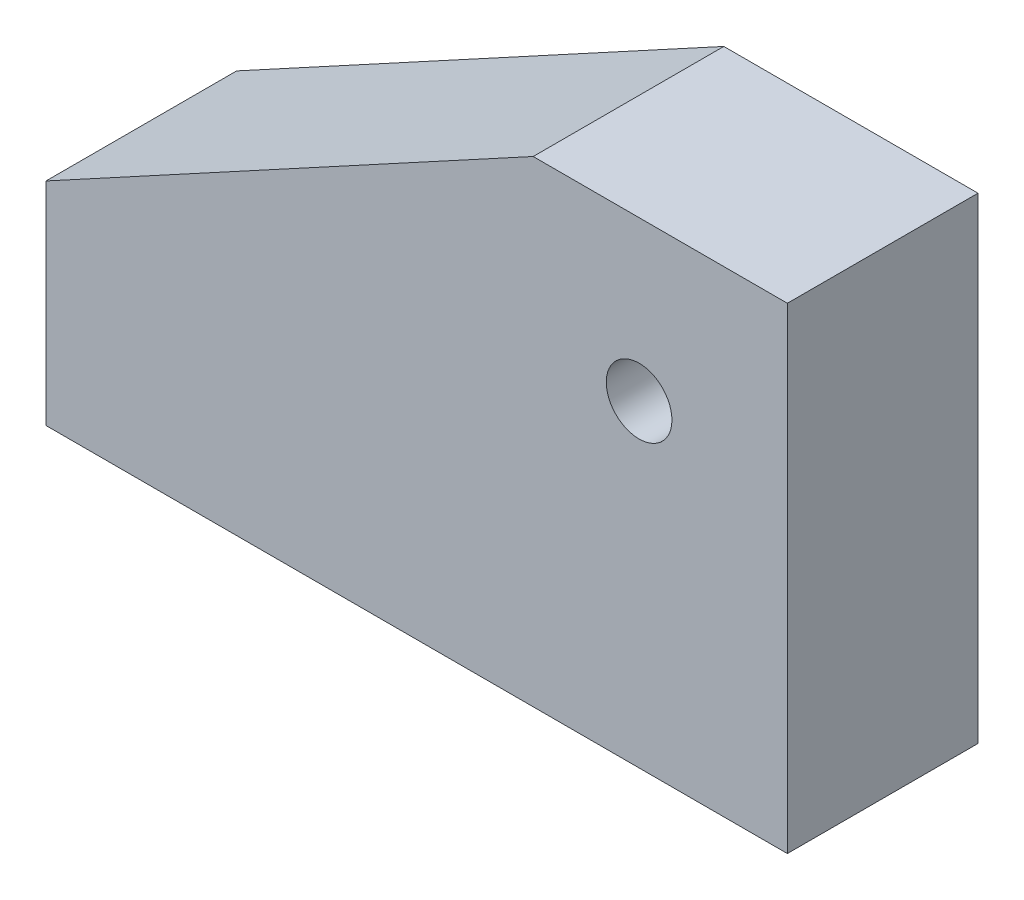
from build123d import *

# Parameters (mm, degrees)
SKETCH1_R           = 3.1
BOSS_EXTRUDE1_DEPTH = 9
SKETCH3_R           = 2
CUT_EXTRUDE1_DEPTH  = 10


with BuildPart() as part:
    # Sketch1 → Boss-Extrude1 (new, symmetric)
    with BuildSketch(Plane.XY):
        Polygon((-35, 0), (35, 0), (35, 45), (11, 45), (-35, 20), align=None)
        with Locations((21, 30)):
            Circle(SKETCH1_R, mode=Mode.SUBTRACT)
    extrude(amount=BOSS_EXTRUDE1_DEPTH, both=True)

    # Sketch3 → Cut-Extrude1 (cut)
    with BuildSketch(Plane.XZ):
        with Locations(Location((19, -5.5, 0), (0, 0, 270))):
            Circle(SKETCH3_R)
        with Locations(Location((-13, -5.5, 0), (0, 0, 270))):
            Circle(SKETCH3_R)
    extrude(amount=-CUT_EXTRUDE1_DEPTH, mode=Mode.SUBTRACT)


solid = part.part
